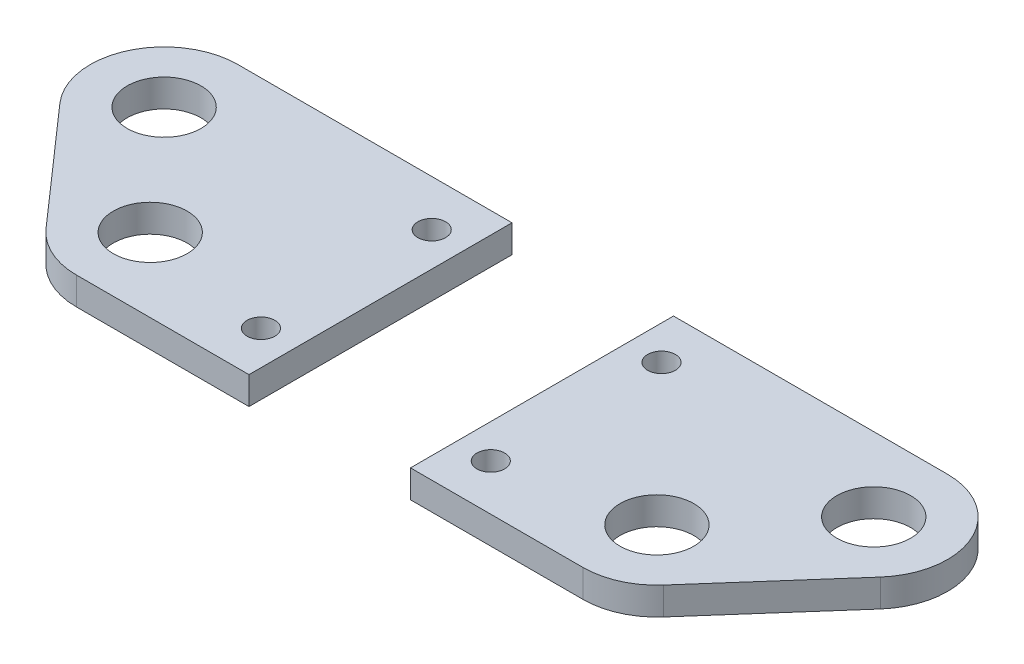
from build123d import *

# Parameters (mm, degrees)
SKETCH1_R             = 1.5
SKETCH1_R_2           = 4.5
BOSS_EXTRUDE1_DEPTH   = 3
BOSS_EXTRUDE1_2_DEPTH = 3
BOSS_EXTRUDE2_START   = -3
SKETCH3_R             = 4.5
SKETCH3_R_2           = 4
BOSS_EXTRUDE2_DEPTH   = 3


with BuildPart() as part:
    # Sketch1 → Boss-Extrude1 (new body)
    with BuildSketch(Plane(origin=(0, 0, 0), x_dir=(1, 0, 0), z_dir=(0, 1, 0))):
        with BuildLine():
            Line((-27.45, -14.25), (-8.75, -14.25))
            Line((-8.75, -14.25), (-8.75, 14.25))
            Line((-8.75, 14.25), (-38.45, 14.25))
            ThreePointArc((-38.45, 14.25), (-45.739725141, 9.545437355), (-44.455708135, 0.964976841))
            Line((-44.455708135, 0.964976841), (-33.455708135, -11.535023159))
            ThreePointArc((-33.455708135, -11.535023159), (-30.745437355, -13.539725141), (-27.45, -14.25))
        make_face()
        with Locations(Location((-12.45, 9.25, 0), (0, 0, 270))):
            Circle(SKETCH1_R, mode=Mode.SUBTRACT)
        with Locations(Location((-12.45, -9.25, 0), (0, 0, 270))):
            Circle(SKETCH1_R, mode=Mode.SUBTRACT)
        with Locations(Location((-38.45, 6.25, 0), (0, 0, 270))):
            Circle(SKETCH1_R_2, mode=Mode.SUBTRACT)
        with Locations(Location((-27.45, -6.25, 0), (0, 0, 270))):
            Circle(SKETCH1_R_2, mode=Mode.SUBTRACT)
    extrude(amount=BOSS_EXTRUDE1_DEPTH)



with BuildPart() as body_2:
    # Sketch1 → Boss-Extrude1 2 (new body)
    with BuildSketch(Plane(origin=(0, 0, 0), x_dir=(1, 0, 0), z_dir=(0, 1, 0))):
        with BuildLine():
            Line((8.75, 14.25), (8.75, -14.25))
            Line((8.75, -14.25), (27.45, -14.25))
            ThreePointArc((27.45, -14.25), (30.745437355, -13.539725141), (33.455708135, -11.535023159))
            Line((33.455708135, -11.535023159), (44.455708135, 0.964976841))
            ThreePointArc((44.455708135, 0.964976841), (45.739725141, 9.545437355), (38.45, 14.25))
            Line((38.45, 14.25), (8.75, 14.25))
        make_face()
        with Locations(Location((27.45, -6.25, 0), (0, 0, 270))):
            Circle(SKETCH1_R_2, mode=Mode.SUBTRACT)
        with Locations(Location((38.45, 6.25, 0), (0, 0, 270))):
            Circle(SKETCH1_R_2, mode=Mode.SUBTRACT)
        with Locations(Location((12.45, -9.25, 0), (0, 0, 270))):
            Circle(SKETCH1_R, mode=Mode.SUBTRACT)
        with Locations(Location((12.45, 9.25, 0), (0, 0, 270))):
            Circle(SKETCH1_R, mode=Mode.SUBTRACT)
    extrude(amount=BOSS_EXTRUDE1_2_DEPTH)


with BuildPart() as part_1:
    add(part.part)

    add(body_2.part)  # Boss-Extrude2 merges body 2
    # Sketch3 → Boss-Extrude2 (add)
    # profile 1 of 4: a face of its own
    with BuildSketch(Plane(origin=(0, 3, 0), x_dir=(1, 0, 0), z_dir=(0, 1, 0)).offset(BOSS_EXTRUDE2_START)):
        with Locations((-38.45, 6.25)):
            Circle(SKETCH3_R)
        with Locations(Location((-38.45, 6.25, 0), (0, 0, 270))):
            Circle(SKETCH3_R_2, mode=Mode.SUBTRACT)
    # profile 2 of 4: a face of its own
    with BuildSketch(Plane(origin=(0, 3, 0), x_dir=(1, 0, 0), z_dir=(0, 1, 0)).offset(BOSS_EXTRUDE2_START)):
        with Locations((-27.45, -6.25)):
            Circle(SKETCH3_R)
        with Locations(Location((-27.45, -6.25, 0), (0, 0, 270))):
            Circle(SKETCH3_R_2, mode=Mode.SUBTRACT)
    # profile 3 of 4: a face of its own
    with BuildSketch(Plane(origin=(0, 3, 0), x_dir=(1, 0, 0), z_dir=(0, 1, 0)).offset(BOSS_EXTRUDE2_START)):
        with Locations((38.45, 6.25)):
            Circle(SKETCH3_R)
        with Locations(Location((38.45, 6.25, 0), (0, 0, 270))):
            Circle(SKETCH3_R_2, mode=Mode.SUBTRACT)
    # profile 4 of 4: a face of its own
    with BuildSketch(Plane(origin=(0, 3, 0), x_dir=(1, 0, 0), z_dir=(0, 1, 0)).offset(BOSS_EXTRUDE2_START)):
        with Locations((27.45, -6.25)):
            Circle(SKETCH3_R)
        with Locations(Location((27.45, -6.25, 0), (0, 0, 270))):
            Circle(SKETCH3_R_2, mode=Mode.SUBTRACT)
    extrude(amount=BOSS_EXTRUDE2_DEPTH)


solid = part_1.part
